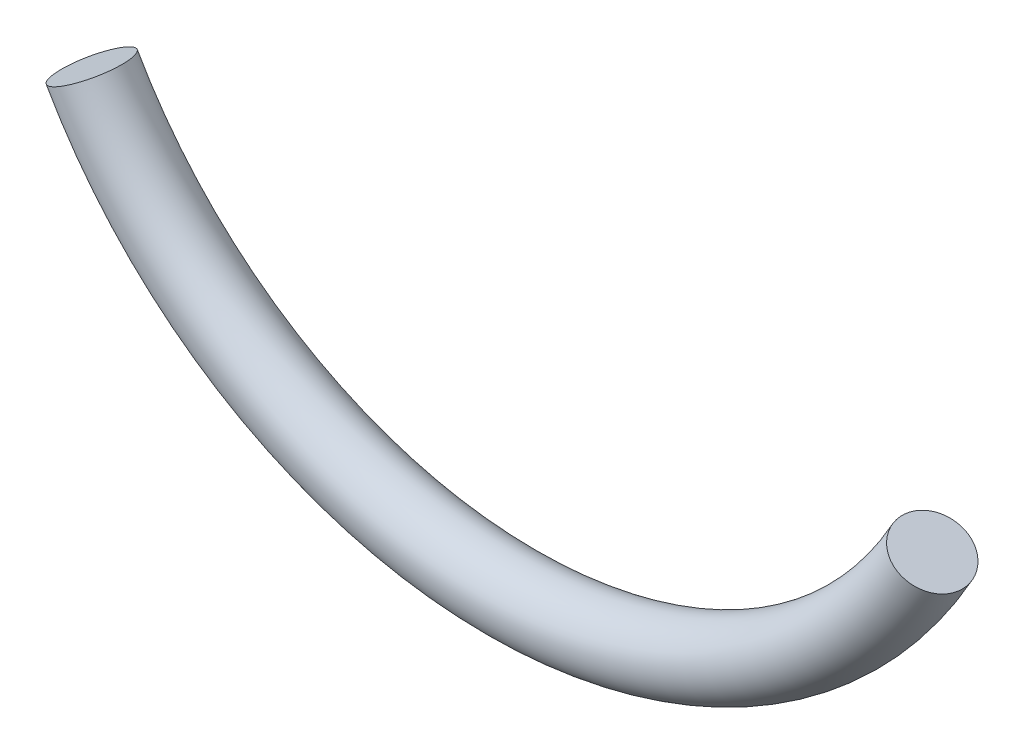
from build123d import *

# Parameters (mm, degrees)
SWEEP1_PROFILE_R = 3.175


with BuildPart() as part:
    # Sweep1: sweep along a curve in space
    with BuildLine() as sweep1_path:
        ThreePointArc((-174.923849042, -109.841525958, 219.8250001), (-136.214, -132.443183065, 219.8250001), (-97.504150958, -109.841525958, 219.8250001))
    # Sweep1 profile (on start of the path) → Sweep1 (sweep)
    with BuildSketch(Plane(origin=(-174.923849042, -109.841525958, 219.8250001), x_dir=(-0.8708627455952885, -0.49152627430711754, 0), z_dir=(0.49152627430711754, -0.8708627455952885, 7.479117909234271e-15))):
        Circle(SWEEP1_PROFILE_R)
    sweep(path=sweep1_path.line)


solid = part.part
